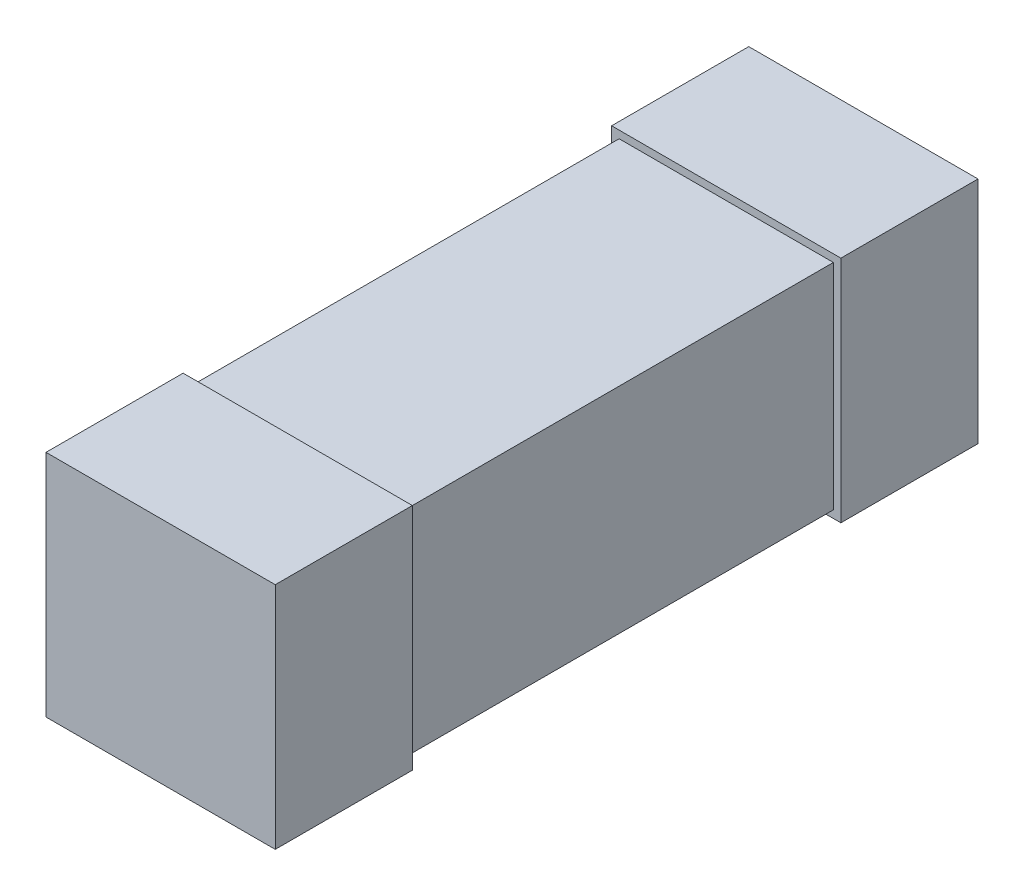
from build123d import *

# Parameters (mm, degrees)
SKETCH1_W           = 5.35
SKETCH1_H           = 5.35
BOSS_EXTRUDE1_DEPTH = 3.2
SKETCH2_W           = 5
SKETCH2_H           = 5
BOSS_EXTRUDE2_DEPTH = 10
SKETCH3_W           = 5.35
SKETCH3_H           = 5.35
BOSS_EXTRUDE3_DEPTH = 3.2


with BuildPart() as part:
    # Sketch1 → Boss-Extrude1 (new body)
    with BuildSketch(Plane.XY):
        with Locations((-2.675, 2.675)):
            Rectangle(SKETCH1_W, SKETCH1_H)
    extrude(amount=BOSS_EXTRUDE1_DEPTH)

    # Sketch2 → Boss-Extrude2 (add)
    with BuildSketch(Plane.XY.offset(3.2)):
        with Locations((-2.675, 2.675)):
            Rectangle(SKETCH2_W, SKETCH2_H)
    extrude(amount=BOSS_EXTRUDE2_DEPTH)

    # Sketch3 → Boss-Extrude3 (add)
    with BuildSketch(Plane.XY.offset(13.2)):
        with Locations((-2.675, 2.675)):
            Rectangle(SKETCH3_W, SKETCH3_H)
    extrude(amount=BOSS_EXTRUDE3_DEPTH)


solid = part.part
